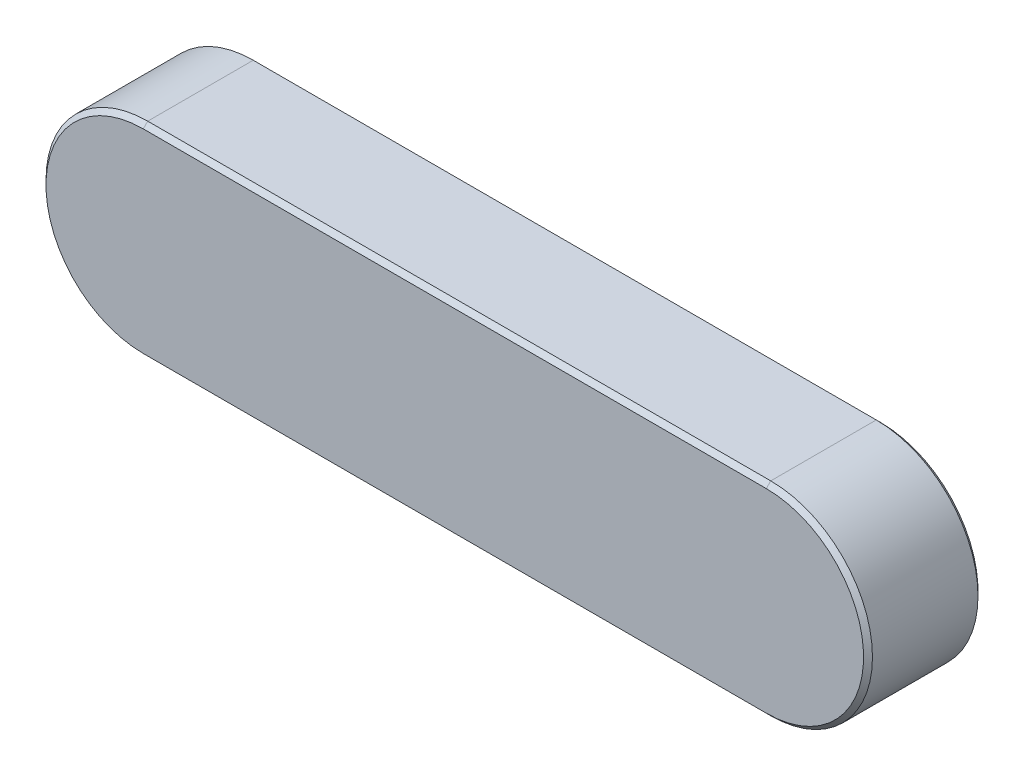
from build123d import *

# Parameters (mm, degrees)
ESTRUSIONE_ESTRUSIONE1_DEPTH = 18
SMUSSO1_SIZE                 = 0.7


with BuildPart() as part:
    # Schizzo1 → Estrusione-Estrusione1 (new body)
    with BuildSketch(Plane.XY):
        with BuildLine():
            Line((0, 16), (98, 16))
            ThreePointArc((98, 16), (114, 0), (98, -16))
            Line((98, -16), (0, -16))
            ThreePointArc((0, -16), (-16, 0), (0, 16))
        make_face()
    extrude(amount=ESTRUSIONE_ESTRUSIONE1_DEPTH)

    # Smusso1
    smusso1_edges = [part.edges().sort_by_distance(p)[0] for p in [
        (114, 0, 18),
        (49, 16, 18),
        (-16, 0, 18),
        (49, 16, 0),
        (114, 0, 0),
        (49, -16, 0),
        (-16, 0, 0),
        (49, -16, 18),
    ]]
    chamfer(smusso1_edges, length=SMUSSO1_SIZE)


solid = part.part
